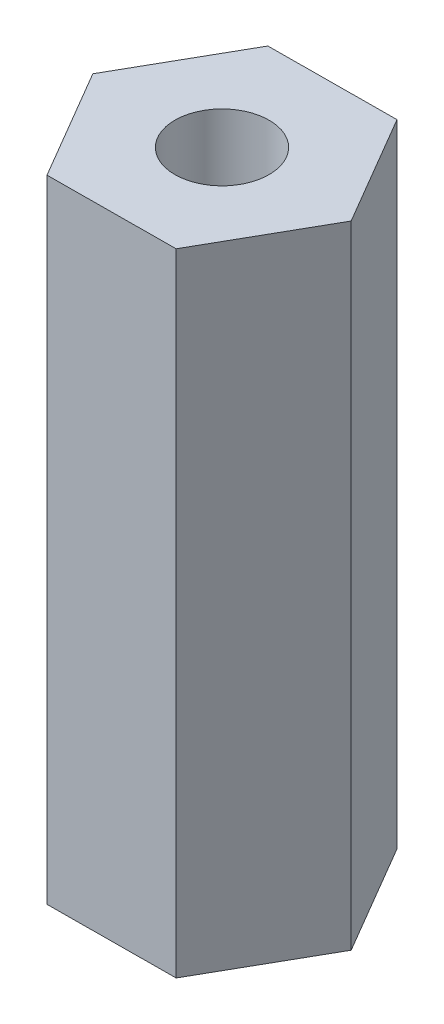
from build123d import *

# Parameters (mm, degrees)
SKETCH2_R           = 2.1209
BOSS_EXTRUDE1_DEPTH = 28.41


with BuildPart() as part:
    # Sketch2 → Boss-Extrude1 (new body)
    with BuildSketch(Plane(origin=(0, 0, 0), x_dir=(1, 0, 0), z_dir=(0, 1, 0))):
        Polygon((2.918646453, -4.981449209), (5.773384789, 0.036897368), (2.854738336, 5.018346577), (-2.918646453, 4.981449209), (-5.773384789, -0.036897368), (-2.854738336, -5.018346577), align=None)
        with Locations(Location((0, 0, 0), (0, 0, 270))):
            Circle(SKETCH2_R, mode=Mode.SUBTRACT)
    extrude(amount=BOSS_EXTRUDE1_DEPTH)


solid = part.part
